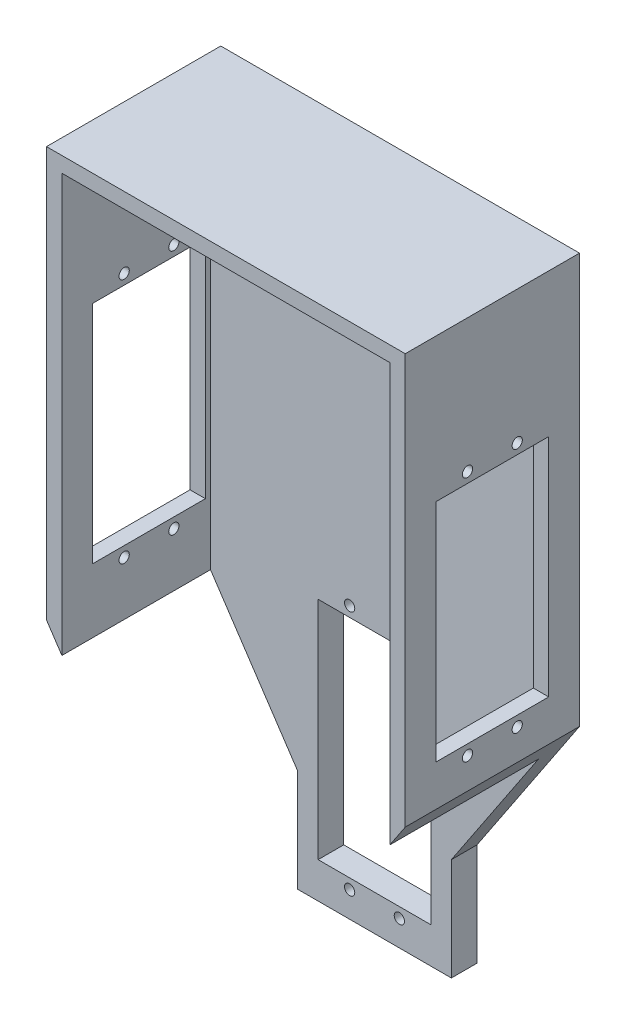
from build123d import *

# Parameters (mm, degrees)
SKETCH1_R           = 1
SKETCH1_W           = 22
SKETCH1_H           = 44
BOSS_EXTRUDE1_DEPTH = 2.5
BOSS_EXTRUDE2_DEPTH = 34
CUT_EXTRUDE1_REACH  = 128.859
SKETCH3_R           = 1
SKETCH3_W           = 22
SKETCH3_H           = 44


with BuildPart() as part:
    # Sketch1 → Boss-Extrude1 (new, symmetric)
    with BuildSketch(Plane.XY):
        Polygon((-15, -29), (15, -29), (15, -9), (35, 21), (35, 101), (-35, 101), (-35, 21), (-15, -9), align=None)
        with Locations((-4.85, -24)):
            Circle(SKETCH1_R, mode=Mode.SUBTRACT)
        with Locations((4.85, -24)):
            Circle(SKETCH1_R, mode=Mode.SUBTRACT)
        with Locations((4.85, 24)):
            Circle(SKETCH1_R, mode=Mode.SUBTRACT)
        with Locations((-4.85, 24)):
            Circle(SKETCH1_R, mode=Mode.SUBTRACT)
        Rectangle(SKETCH1_W, SKETCH1_H, mode=Mode.SUBTRACT)
    extrude(amount=BOSS_EXTRUDE1_DEPTH, both=True)

    # Sketch2 → Boss-Extrude2 (add)
    with BuildSketch(Plane.XY.offset(-2.5)):
        Polygon((-35, 101), (-35, 21), (-32, 16.5), (-32, 98), (32, 98), (32, 16.5), (35, 21), (35, 101), align=None)
    extrude(amount=BOSS_EXTRUDE2_DEPTH)

    # Cut-Extrude1: up to this face of the body (flat: up to its plane)
    cut_extrude1_end = Plane(part.part.faces().sort_by_distance((35, 61, 14.5))[0])
    # Sketch3 → Cut-Extrude1 (cut, up to the picked face)
    with BuildSketch(Plane.ZY.offset(35), mode=Mode.PRIVATE) as cut_extrude1_sk1:
        with Locations(Location((9.65, 27, 0), (0, 0, 270))):
            Circle(SKETCH3_R)
    cut_extrude1_tool1 = split(extrude(cut_extrude1_sk1.sketch, amount=-CUT_EXTRUDE1_REACH, mode=Mode.PRIVATE), bisect_by=cut_extrude1_end, keep=Keep.BOTH, mode=Mode.PRIVATE)
    # Sketch3 → Cut-Extrude1 (cut, up to the picked face)
    with BuildSketch(Plane.ZY.offset(35), mode=Mode.PRIVATE) as cut_extrude1_sk2:
        with Locations(Location((19.35, 27, 0), (0, 0, 270))):
            Circle(SKETCH3_R)
    cut_extrude1_tool2 = split(extrude(cut_extrude1_sk2.sketch, amount=-CUT_EXTRUDE1_REACH, mode=Mode.PRIVATE), bisect_by=cut_extrude1_end, keep=Keep.BOTH, mode=Mode.PRIVATE)
    # Sketch3 → Cut-Extrude1 (cut, up to the picked face)
    with BuildSketch(Plane.ZY.offset(35), mode=Mode.PRIVATE) as cut_extrude1_sk3:
        with Locations(Location((19.35, 75, 0), (0, 0, 270))):
            Circle(SKETCH3_R)
    cut_extrude1_tool3 = split(extrude(cut_extrude1_sk3.sketch, amount=-CUT_EXTRUDE1_REACH, mode=Mode.PRIVATE), bisect_by=cut_extrude1_end, keep=Keep.BOTH, mode=Mode.PRIVATE)
    # Sketch3 → Cut-Extrude1 (cut, up to the picked face)
    with BuildSketch(Plane.ZY.offset(35), mode=Mode.PRIVATE) as cut_extrude1_sk4:
        with Locations(Location((9.65, 75, 0), (0, 0, 270))):
            Circle(SKETCH3_R)
    cut_extrude1_tool4 = split(extrude(cut_extrude1_sk4.sketch, amount=-CUT_EXTRUDE1_REACH, mode=Mode.PRIVATE), bisect_by=cut_extrude1_end, keep=Keep.BOTH, mode=Mode.PRIVATE)
    # Sketch3 → Cut-Extrude1 (cut, up to the picked face)
    with BuildSketch(Plane.ZY.offset(35), mode=Mode.PRIVATE) as cut_extrude1_sk5:
        with Locations((14.5, 51)):
            Rectangle(SKETCH3_W, SKETCH3_H)
    cut_extrude1_tool5 = split(extrude(cut_extrude1_sk5.sketch, amount=-CUT_EXTRUDE1_REACH, mode=Mode.PRIVATE), bisect_by=cut_extrude1_end, keep=Keep.BOTH, mode=Mode.PRIVATE)
    add(cut_extrude1_tool1.solids().sort_by(Axis((-35, 27, 9.65), (1, 0, 0)))[0], mode=Mode.SUBTRACT)
    add(cut_extrude1_tool2.solids().sort_by(Axis((-35, 27, 19.35), (1, 0, 0)))[0], mode=Mode.SUBTRACT)
    add(cut_extrude1_tool3.solids().sort_by(Axis((-35, 75, 19.35), (1, 0, 0)))[0], mode=Mode.SUBTRACT)
    add(cut_extrude1_tool4.solids().sort_by(Axis((-35, 75, 9.65), (1, 0, 0)))[0], mode=Mode.SUBTRACT)
    add(cut_extrude1_tool5.solids().sort_by(Axis((-35, 51, 14.5), (1, 0, 0)))[0], mode=Mode.SUBTRACT)


solid = part.part
